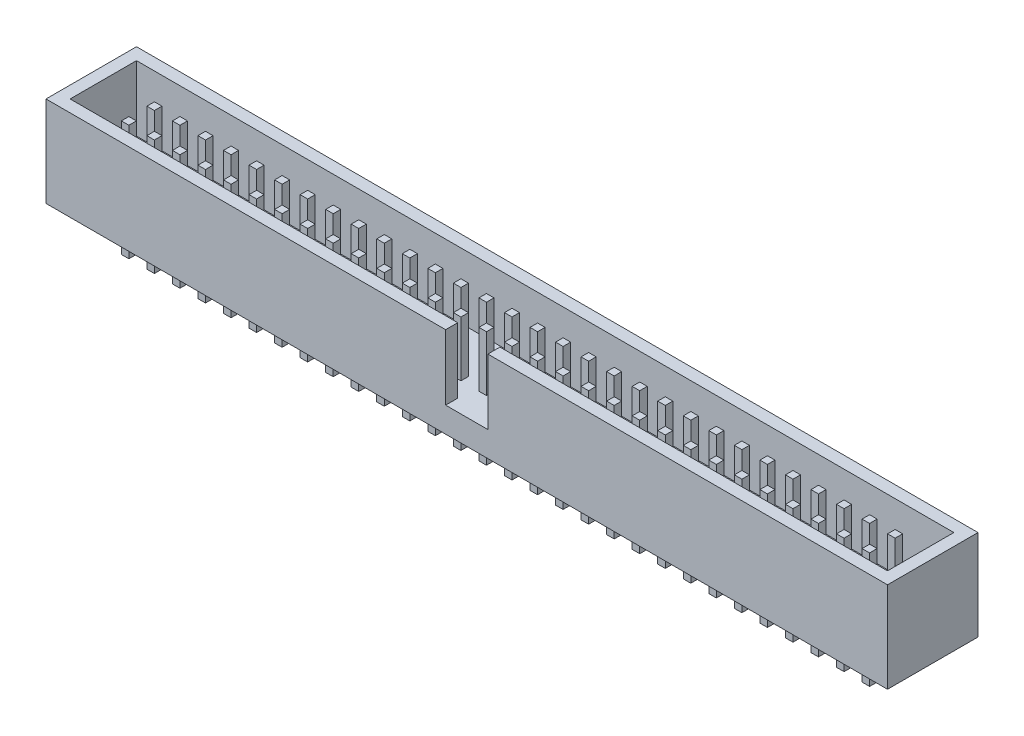
from build123d import *

# Parameters (mm, degrees)
SKETCH_1_W           = 83.68
SKETCH_1_H           = 9
EXTRUDE_1_DEPTH      = 9
SKETCH_2_W           = 81.28
SKETCH_2_H           = 6.6
CUT_EXTRUDE_1_DEPTH  = 6.5
SKETCH_3_W           = 4.2
SKETCH_3_H           = 6.5
CUT_EXTRUDE_2_DEPTH  = 6.5
EXTRUDE_2_DEPTH      = 3.5
EXTRUDE_2_DEPTH_BACK = 8
SKETCH_5_W           = 0.75
SKETCH_5_H           = 0.75


with BuildPart() as part:
    # 草图1 → 拉伸1 (new body)
    with BuildSketch(Plane(origin=(0, 0, 0), x_dir=(1, 0, 0), z_dir=(0, 1, 0))):
        Rectangle(SKETCH_1_W, SKETCH_1_H)
    extrude(amount=EXTRUDE_1_DEPTH)

    # 草图2 → 切除-拉伸1 (cut)
    with BuildSketch(Plane(origin=(0, 9, 0), x_dir=(-1, 0, 0), z_dir=(0, 1, 0))):
        Rectangle(SKETCH_2_W, SKETCH_2_H)
    extrude(amount=-CUT_EXTRUDE_1_DEPTH, mode=Mode.SUBTRACT)

    # 草图3 → 切除-拉伸2 (cut)
    with BuildSketch(Plane.XY.offset(4.5)):
        with Locations((0, 5.75)):
            Rectangle(SKETCH_3_W, SKETCH_3_H)
    extrude(amount=-CUT_EXTRUDE_2_DEPTH, mode=Mode.SUBTRACT)

    # 草图5 → 拉伸2 (add, two sides: drawn at the far end of the back side and taken through both)
    with BuildSketch(Plane.XZ.offset(-EXTRUDE_2_DEPTH_BACK)):
        with Locations((-1.27, 1.27)):
            Rectangle(SKETCH_5_W, SKETCH_5_H)
        with Locations((3.81, -1.27)):
            Rectangle(SKETCH_5_W, SKETCH_5_H)
        with Locations((3.81, 1.27)):
            Rectangle(SKETCH_5_W, SKETCH_5_H)
        with Locations((6.35, -1.27)):
            Rectangle(SKETCH_5_W, SKETCH_5_H)
        with Locations((6.35, 1.27)):
            Rectangle(SKETCH_5_W, SKETCH_5_H)
        with Locations((8.89, -1.27)):
            Rectangle(SKETCH_5_W, SKETCH_5_H)
        with Locations((8.89, 1.27)):
            Rectangle(SKETCH_5_W, SKETCH_5_H)
        with Locations((-1.27, -1.27)):
            Rectangle(SKETCH_5_W, SKETCH_5_H)
        with Locations((1.27, -1.27)):
            Rectangle(SKETCH_5_W, SKETCH_5_H)
        with Locations((11.43, -1.27)):
            Rectangle(SKETCH_5_W, SKETCH_5_H)
        with Locations((11.43, 1.27)):
            Rectangle(SKETCH_5_W, SKETCH_5_H)
        with Locations((13.97, -1.27)):
            Rectangle(SKETCH_5_W, SKETCH_5_H)
        with Locations((13.97, 1.27)):
            Rectangle(SKETCH_5_W, SKETCH_5_H)
        with Locations((16.51, -1.27)):
            Rectangle(SKETCH_5_W, SKETCH_5_H)
        with Locations((1.27, 1.27)):
            Rectangle(SKETCH_5_W, SKETCH_5_H)
        with Locations((16.51, 1.27)):
            Rectangle(SKETCH_5_W, SKETCH_5_H)
        with Locations((19.05, -1.27)):
            Rectangle(SKETCH_5_W, SKETCH_5_H)
        with Locations((19.05, 1.27)):
            Rectangle(SKETCH_5_W, SKETCH_5_H)
        with Locations((21.59, -1.27)):
            Rectangle(SKETCH_5_W, SKETCH_5_H)
        with Locations((21.59, 1.27)):
            Rectangle(SKETCH_5_W, SKETCH_5_H)
        with Locations((24.13, -1.27)):
            Rectangle(SKETCH_5_W, SKETCH_5_H)
        with Locations((24.13, 1.27)):
            Rectangle(SKETCH_5_W, SKETCH_5_H)
        with Locations((26.67, -1.27)):
            Rectangle(SKETCH_5_W, SKETCH_5_H)
        with Locations((26.67, 1.27)):
            Rectangle(SKETCH_5_W, SKETCH_5_H)
        with Locations((29.21, -1.27)):
            Rectangle(SKETCH_5_W, SKETCH_5_H)
        with Locations((29.21, 1.27)):
            Rectangle(SKETCH_5_W, SKETCH_5_H)
        with Locations((31.75, -1.27)):
            Rectangle(SKETCH_5_W, SKETCH_5_H)
        with Locations((31.75, 1.27)):
            Rectangle(SKETCH_5_W, SKETCH_5_H)
        with Locations((34.29, -1.27)):
            Rectangle(SKETCH_5_W, SKETCH_5_H)
        with Locations((34.29, 1.27)):
            Rectangle(SKETCH_5_W, SKETCH_5_H)
        with Locations((36.83, -1.27)):
            Rectangle(SKETCH_5_W, SKETCH_5_H)
        with Locations((36.83, 1.27)):
            Rectangle(SKETCH_5_W, SKETCH_5_H)
        with Locations((-3.81, 1.27)):
            Rectangle(SKETCH_5_W, SKETCH_5_H)
        with Locations((-3.81, -1.27)):
            Rectangle(SKETCH_5_W, SKETCH_5_H)
        with Locations((-6.35, 1.27)):
            Rectangle(SKETCH_5_W, SKETCH_5_H)
        with Locations((-6.35, -1.27)):
            Rectangle(SKETCH_5_W, SKETCH_5_H)
        with Locations((-8.89, 1.27)):
            Rectangle(SKETCH_5_W, SKETCH_5_H)
        with Locations((-8.89, -1.27)):
            Rectangle(SKETCH_5_W, SKETCH_5_H)
        with Locations((-11.43, 1.27)):
            Rectangle(SKETCH_5_W, SKETCH_5_H)
        with Locations((-11.43, -1.27)):
            Rectangle(SKETCH_5_W, SKETCH_5_H)
        with Locations((-13.97, 1.27)):
            Rectangle(SKETCH_5_W, SKETCH_5_H)
        with Locations((-13.97, -1.27)):
            Rectangle(SKETCH_5_W, SKETCH_5_H)
        with Locations((-16.51, 1.27)):
            Rectangle(SKETCH_5_W, SKETCH_5_H)
        with Locations((-16.51, -1.27)):
            Rectangle(SKETCH_5_W, SKETCH_5_H)
        with Locations((-19.05, 1.27)):
            Rectangle(SKETCH_5_W, SKETCH_5_H)
        with Locations((-19.05, -1.27)):
            Rectangle(SKETCH_5_W, SKETCH_5_H)
        with Locations((-21.59, 1.27)):
            Rectangle(SKETCH_5_W, SKETCH_5_H)
        with Locations((-21.59, -1.27)):
            Rectangle(SKETCH_5_W, SKETCH_5_H)
        with Locations((-24.13, 1.27)):
            Rectangle(SKETCH_5_W, SKETCH_5_H)
        with Locations((-24.13, -1.27)):
            Rectangle(SKETCH_5_W, SKETCH_5_H)
        with Locations((-26.67, 1.27)):
            Rectangle(SKETCH_5_W, SKETCH_5_H)
        with Locations((-26.67, -1.27)):
            Rectangle(SKETCH_5_W, SKETCH_5_H)
        with Locations((-29.21, 1.27)):
            Rectangle(SKETCH_5_W, SKETCH_5_H)
        with Locations((-29.21, -1.27)):
            Rectangle(SKETCH_5_W, SKETCH_5_H)
        with Locations((-31.75, 1.27)):
            Rectangle(SKETCH_5_W, SKETCH_5_H)
        with Locations((-31.75, -1.27)):
            Rectangle(SKETCH_5_W, SKETCH_5_H)
        with Locations((-34.29, 1.27)):
            Rectangle(SKETCH_5_W, SKETCH_5_H)
        with Locations((-34.29, -1.27)):
            Rectangle(SKETCH_5_W, SKETCH_5_H)
        with Locations((-36.83, 1.27)):
            Rectangle(SKETCH_5_W, SKETCH_5_H)
        with Locations((-36.83, -1.27)):
            Rectangle(SKETCH_5_W, SKETCH_5_H)
    extrude(amount=EXTRUDE_2_DEPTH + EXTRUDE_2_DEPTH_BACK)


solid = part.part
